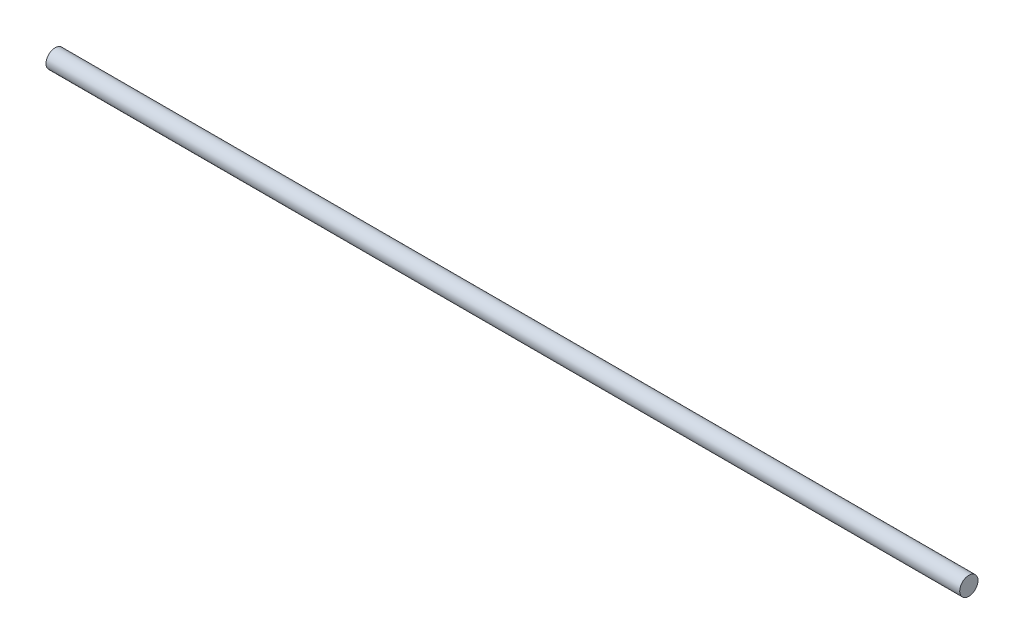
from build123d import *

# Parameters (mm, degrees)
SKETCH1_R           = 4
BOSS_EXTRUDE1_DEPTH = 400


with BuildPart() as part:
    # Sketch1 → Boss-Extrude1 (new body)
    with BuildSketch(Plane(origin=(0, 0, 0), x_dir=(0, 0, -1), z_dir=(1, 0, 0))):
        Circle(SKETCH1_R)
    extrude(amount=BOSS_EXTRUDE1_DEPTH)


solid = part.part
